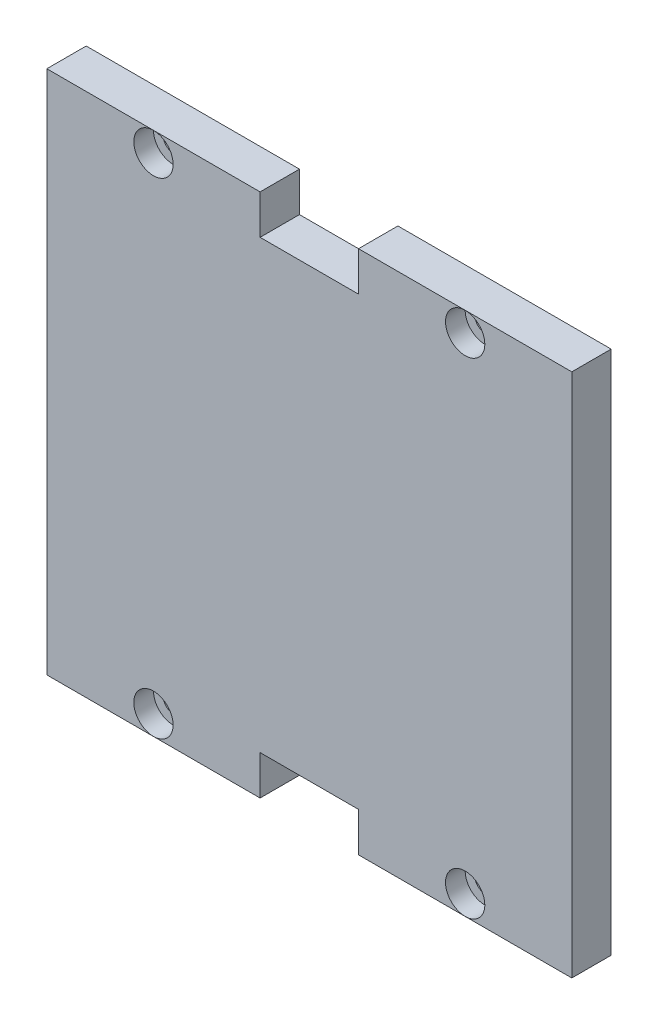
from build123d import *

# Parameters (mm, degrees)
ESQUISSE1_W             = 80
ESQUISSE1_H             = 80
BOSS_EXTRU_1_DEPTH      = 6
ESQUISSE2_R             = 1.5
ESQUISSE2_W             = 15
ESQUISSE2_H             = 6
ENL_V_MAT_EXTRU_1_DEPTH = 6
ESQUISSE3_R             = 2.995
ENL_V_MAT_EXTRU_2_DEPTH = 3


with BuildPart() as part:
    # Esquisse1 → Boss.-Extru.1 (new body)
    with BuildSketch(Plane.XY):
        with Locations((-40, 40)):
            Rectangle(ESQUISSE1_W, ESQUISSE1_H)
    extrude(amount=BOSS_EXTRU_1_DEPTH)

    # Esquisse2 → Enlèv. mat.-Extru.1 (cut)
    with BuildSketch(Plane.XY.offset(6)):
        with Locations((-16.25, 3)):
            Circle(ESQUISSE2_R)
        with Locations(Location((-63.75, 77, 0), (0, 0, 180))):
            Circle(ESQUISSE2_R)
        with Locations(Location((-16.25, 77, 0), (0, 0, 180))):
            Circle(ESQUISSE2_R)
        with Locations((-63.75, 3)):
            Circle(ESQUISSE2_R)
        with Locations((-40, 3)):
            Rectangle(ESQUISSE2_W, ESQUISSE2_H)
        with Locations((-40, 77)):
            Rectangle(ESQUISSE2_W, ESQUISSE2_H)
    extrude(amount=-ENL_V_MAT_EXTRU_1_DEPTH, mode=Mode.SUBTRACT)

    # Esquisse3 → Enlèv. mat.-Extru.2 (cut)
    with BuildSketch(Plane.XY.offset(6)):
        with Locations((-16.25, 3)):
            Circle(ESQUISSE3_R)
        with Locations((-63.75, 3)):
            Circle(ESQUISSE3_R)
        with Locations((-16.25, 77)):
            Circle(ESQUISSE3_R)
        with Locations((-63.75, 77)):
            Circle(ESQUISSE3_R)
    extrude(amount=-ENL_V_MAT_EXTRU_2_DEPTH, mode=Mode.SUBTRACT)


solid = part.part
